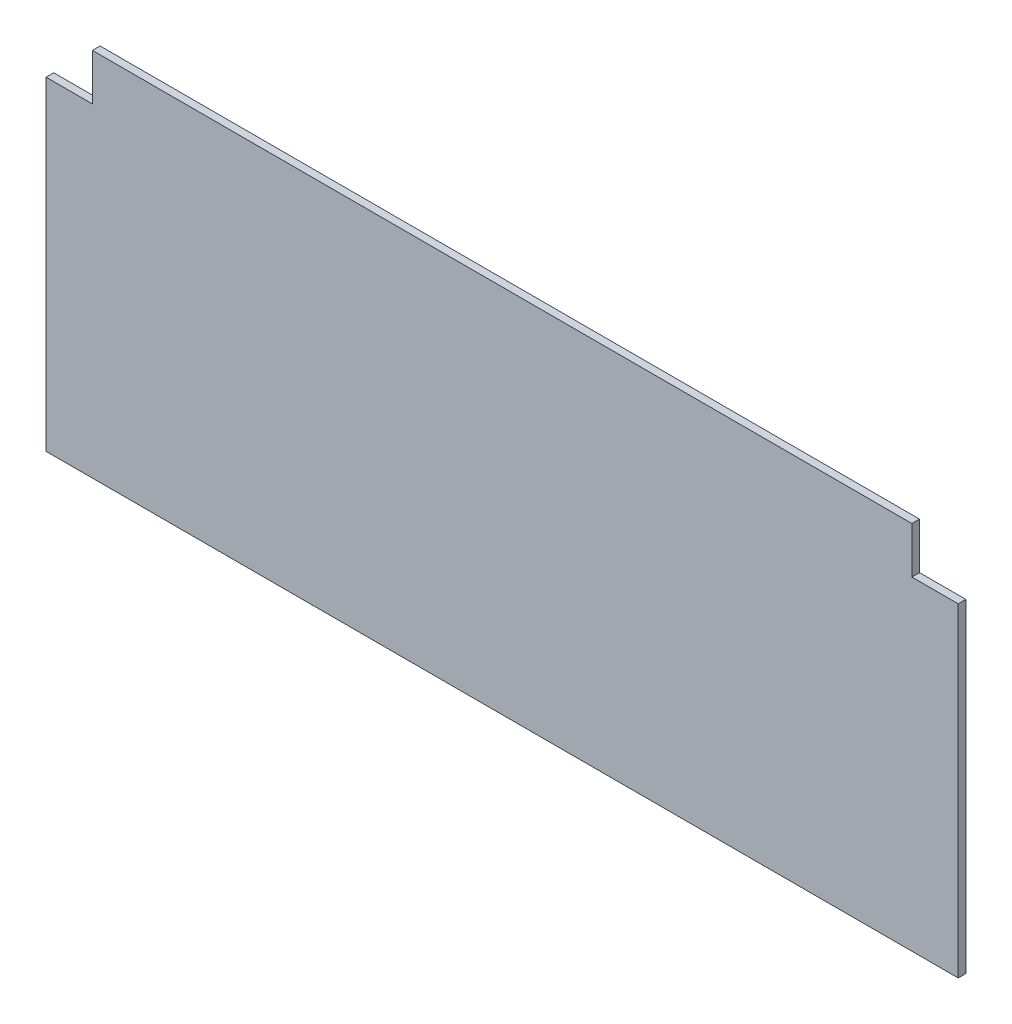
from build123d import *

# Parameters (mm, degrees)
SKETCH1_W           = 393.4
SKETCH1_H           = 139.768276909
SKETCH1_W_2         = 353.4
SKETCH1_H_2         = 20
BOSS_EXTRUDE1_DEPTH = 3.3


with BuildPart() as part:
    # Sketch1 → Boss-Extrude1 (new body)
    with BuildSketch(Plane.XY):
        with Locations((196.7, -109.688432202)):
            Rectangle(SKETCH1_W, SKETCH1_H)
        with Locations((196.7, -29.804293747)):
            Rectangle(SKETCH1_W_2, SKETCH1_H_2)
    extrude(amount=-BOSS_EXTRUDE1_DEPTH)


solid = part.part
